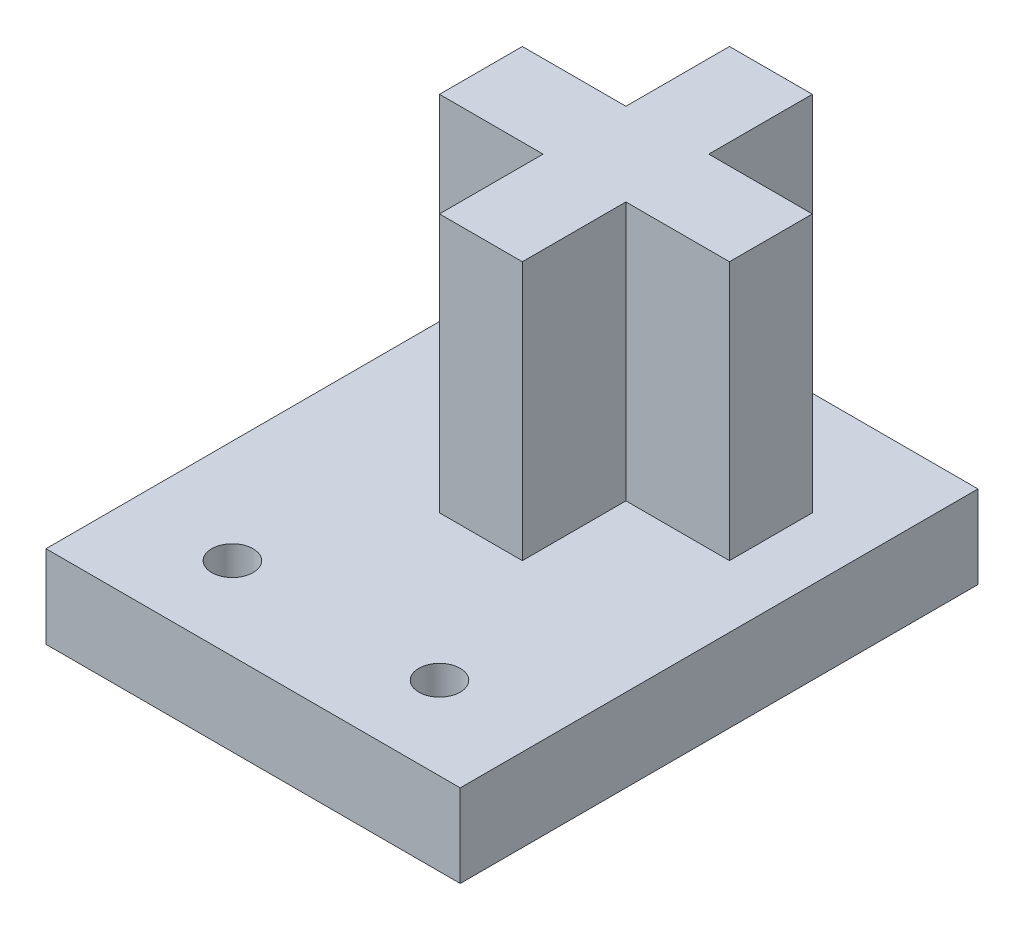
from build123d import *

# Parameters (mm, degrees)
SKETCH1_W           = 40
SKETCH1_H           = 50
SKETCH1_R           = 2
BOSS_EXTRUDE1_DEPTH = 8
BOSS_EXTRUDE2_DEPTH = 25


with BuildPart() as part:
    # Sketch1 → Boss-Extrude1 (new body)
    with BuildSketch(Plane(origin=(0, 0, 0), x_dir=(1, 0, 0), z_dir=(0, 1, 0))):
        Rectangle(SKETCH1_W, SKETCH1_H)
        with Locations(Location((-10, -17, 0), (0, 0, 270))):
            Circle(SKETCH1_R, mode=Mode.SUBTRACT)
        with Locations(Location((10, -17, 0), (0, 0, 90))):
            Circle(SKETCH1_R, mode=Mode.SUBTRACT)
    extrude(amount=BOSS_EXTRUDE1_DEPTH)

    # Sketch2 → Boss-Extrude2 (add)
    with BuildSketch(Plane(origin=(0, 8, 0), x_dir=(1, 0, 0), z_dir=(0, 1, 0))):
        Polygon((-4, 25), (4, 25), (4, 15), (14, 15), (14, 7), (4, 7), (4, -3), (-4, -3), (-4, 7), (-14, 7), (-14, 15), (-4, 15), align=None)
    extrude(amount=BOSS_EXTRUDE2_DEPTH)


solid = part.part
